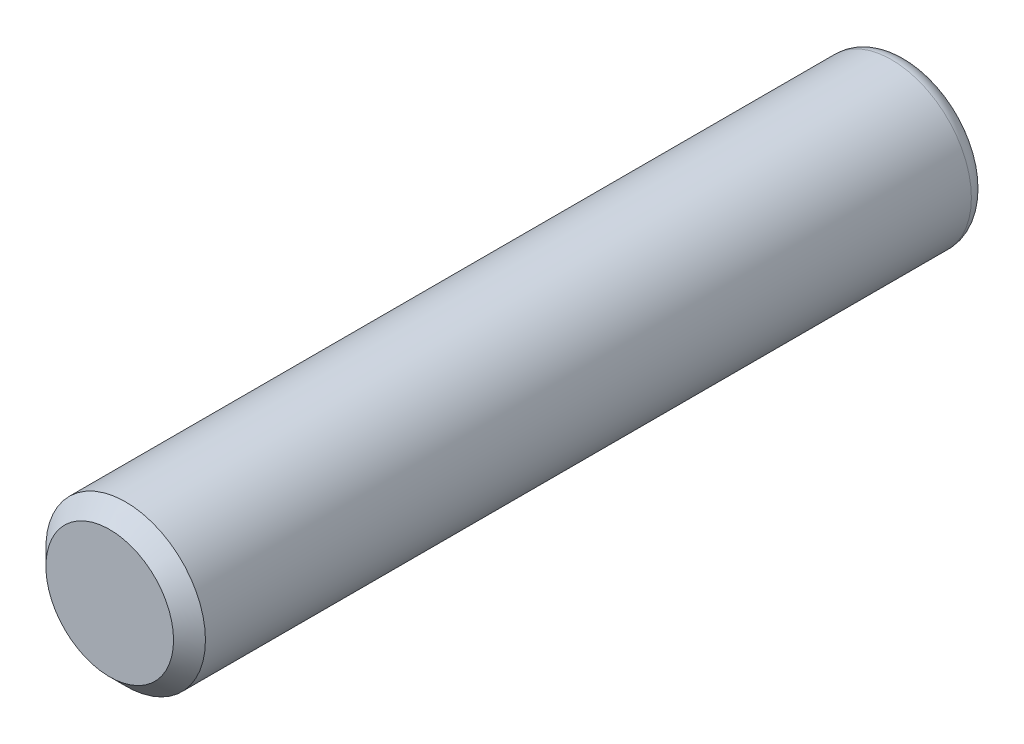
from build123d import *


with BuildPart() as part:
    # Sketch2 → Revolve1 (revolve)
    with BuildSketch(Plane(origin=(0, 0, 0), x_dir=(0, 0, -1), z_dir=(1, 0, 0)), mode=Mode.PRIVATE) as revolve1_sk:
        with BuildLine():
            Line((7.9375, 1.27), (7.9375, 0))
            Line((7.9375, 0), (-7.9375, 0))
            Line((-7.9375, 0), (-7.9375, 1.27))
            Line((-7.9375, 1.27), (-7.62, 1.5875))
            Line((-7.62, 1.5875), (7.62, 1.5875))
            ThreePointArc((7.62, 1.5875), (7.844506403, 1.494506403), (7.9375, 1.27))
        make_face()
    revolve(revolve1_sk.sketch.rotate(Axis((0, 0, 7.9375), (0, 0, -1)), 90), axis=Axis((0, 0, 7.9375), (0, 0, -1)))


solid = part.part
